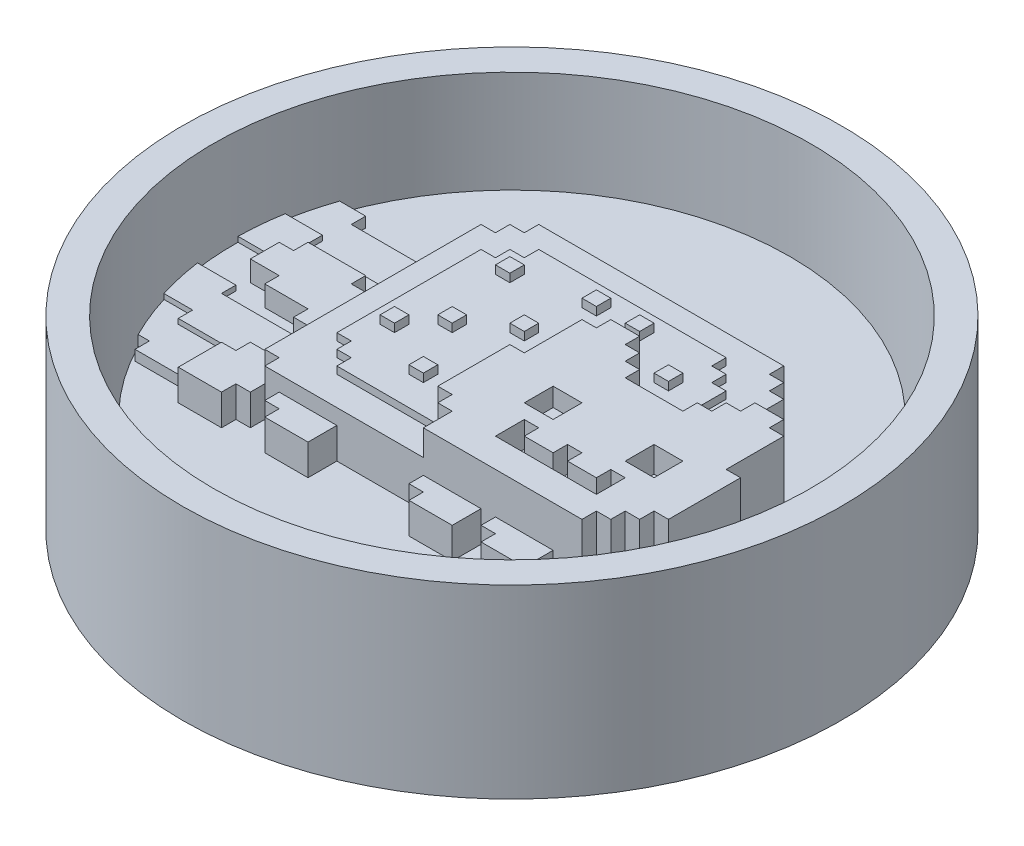
from build123d import *
from build123d.topology import SkipClean

# Parameters (mm, degrees)
FACE_3_W            = 7.112
FACE_3_H            = 7.112
FACE_2_DEPTH        = 17.78
FEETTAIL_DEPTH      = 7.62
POPTART_DEPTH       = 11.43
SPRINKLES_W         = 3.556
SPRINKLES_H         = 3.556
SPRINKLE_DEPTH      = 15.24
ENGRAVE_DEPTH       = 13.208
SKETCH2_R           = 68.58
CUPCAKE_DEPTH       = 15.24
RETAINING_START     = 21.59
SKETCH4_R           = 157.48
SKETCH4_R_2         = 73.66
RETAINING_DEPTH     = 45.72
CUPCAKE_START       = -17.78
SKETCH5_R           = 81.28
CUPCAKE_BODY_DEPTH  = 6.35
BOSS_EXTRUDE1_DEPTH = 2.54
BOSS_EXTRUDE2_DEPTH = 3.81
SKETCH15_R          = 157.48
SKETCH15_R_2        = 81.28
BOSS_EXTRUDE4_DEPTH = 45.72
SKETCH15_2_R        = 157.48
SKETCH15_2_R_2      = 81.28
CUT_EXTRUDE1_DEPTH  = 345.598533949


with BuildPart() as part:
    # face 3 → face 2 (new body)
    with BuildSketch(Plane(origin=(0, 0, 0), x_dir=(1, 0, 0), z_dir=(0, 1, 0))):
        Polygon((103.124, 88.9), (110.236, 88.9), (110.236, 85.344), (113.792, 85.344), (113.792, 81.788), (117.348, 81.788), (117.348, 78.232), (131.572, 78.232), (131.572, 81.788), (135.128, 81.788), (135.128, 85.344), (138.684, 85.344), (138.684, 88.9), (145.796, 88.9), (145.796, 85.344), (149.352, 85.344), (149.352, 71.12), (152.908, 71.12), (152.908, 53.34), (149.352, 53.34), (149.352, 49.784), (145.796, 49.784), (145.796, 46.228), (142.24, 46.228), (142.24, 42.672), (103.124, 42.672), (103.124, 49.784), (99.568, 49.784), (99.568, 53.34), (96.012, 53.34), (96.012, 71.12), (99.568, 71.12), (99.568, 85.344), (103.124, 85.344), align=None)
        with Locations((113.792, 64.008)):
            Rectangle(FACE_3_W, FACE_3_H, mode=Mode.SUBTRACT)
        with Locations((138.684, 64.008)):
            Rectangle(FACE_3_W, FACE_3_H, mode=Mode.SUBTRACT)
        Polygon((113.792, 56.896), (113.792, 49.784), (138.684, 49.784), (138.684, 56.896), (135.128, 56.896), (135.128, 53.34), (128.016, 53.34), (128.016, 56.896), (124.46, 56.896), (124.46, 53.34), (117.348, 53.34), (117.348, 56.896), align=None, mode=Mode.SUBTRACT)
    extrude(amount=FACE_2_DEPTH)

    # feet tail → feettail (add)
    with BuildSketch(Plane(origin=(0, 0, 0), x_dir=(1, 0, 0), z_dir=(0, 1, 0))):
        Polygon((60.452, 74.676), (53.34, 74.676), (53.34, 78.232), (39.116, 78.232), (39.116, 74.676), (35.56, 74.676), (35.56, 67.564), (42.672, 67.564), (42.672, 64.008), (53.34, 64.008), (53.34, 60.452), (60.452, 60.452), align=None)
        Polygon((60.452, 53.34), (56.896, 53.34), (56.896, 49.784), (53.34, 49.784), (53.34, 46.228), (49.784, 46.228), (49.784, 35.56), (60.452, 35.56), (60.452, 39.116), (64.008, 39.116), (64.008, 46.228), (60.452, 46.228), align=None)
        Polygon((67.564, 42.672), (67.564, 39.116), (71.12, 39.116), (71.12, 35.56), (81.788, 35.56), (81.788, 42.672), align=None)
        Polygon((103.124, 42.672), (103.124, 39.116), (106.68, 39.116), (106.68, 35.56), (117.348, 35.56), (117.348, 42.672), align=None)
        Polygon((120.904, 42.672), (120.904, 39.116), (124.46, 39.116), (124.46, 35.56), (135.128, 35.56), (135.128, 42.672), align=None)
    extrude(amount=FEETTAIL_DEPTH)


with BuildPart() as feettail_piece_1:
    # of the separate pieces the step leaves, piece 1, a body of its own (feettail_pieces)
    add(part.part.solids().sort_by_distance((103.124, 0, -88.9))[0])



with BuildPart() as feettail_piece_2:
    # of the separate pieces the step leaves, piece 2, a body of its own (feettail_pieces)
    add(part.part.solids().sort_by_distance((60.452, 0, -74.676))[0])


with BuildPart() as feettail_piece_3:
    # of the separate pieces the step leaves, piece 3, a body of its own (feettail_pieces)
    add(part.part.solids().sort_by_distance((60.452, 0, -53.34))[0])


with BuildPart() as feettail_piece_4:
    # of the separate pieces the step leaves, piece 4, a body of its own (feettail_pieces)
    add(part.part.solids().sort_by_distance((67.564, 0, -42.672))[0])


with BuildPart() as feettail_piece_1_1:
    add(feettail_piece_1.part)

    add(feettail_piece_3.part)  # poptart merges feettail piece 3

    add(feettail_piece_4.part)  # poptart merges feettail piece 4
    # poptart 2 → poptart (add)
    with BuildSketch(Plane(origin=(0, 0, 0), x_dir=(1, 0, 0), z_dir=(0, 1, 0))):
        Polygon((135.128, 99.568), (131.572, 99.568), (131.572, 103.124), (128.016, 103.124), (128.016, 106.68), (67.564, 106.68), (67.564, 103.124), (64.008, 103.124), (64.008, 99.568), (60.452, 99.568), (60.452, 46.228), (64.008, 46.228), (64.008, 42.672), (135.128, 42.672), (145.796, 53.34), (145.796, 71.12), (135.128, 85.344), align=None)
    extrude(amount=POPTART_DEPTH)

    # sprinkles → sprinkle (add)
    with BuildSketch(Plane(origin=(0, 0, 0), x_dir=(1, 0, 0), z_dir=(0, 1, 0))):
        with Locations((72.898, 65.786)):
            Rectangle(SPRINKLES_W, SPRINKLES_H)
        with Locations((80.01, 72.898)):
            Rectangle(SPRINKLES_W, SPRINKLES_H)
        with Locations((90.678, 80.01)):
            Rectangle(SPRINKLES_W, SPRINKLES_H)
        with Locations((76.454, 90.678)):
            Rectangle(SPRINKLES_W, SPRINKLES_H)
        with Locations((94.234, 94.234)):
            Rectangle(SPRINKLES_W, SPRINKLES_H)
        with Locations((104.902, 94.234)):
            Rectangle(SPRINKLES_W, SPRINKLES_H)
        with Locations((119.126, 87.122)):
            Rectangle(SPRINKLES_W, SPRINKLES_H)
        with Locations((87.122, 58.674)):
            Rectangle(SPRINKLES_W, SPRINKLES_H)
    extrude(amount=SPRINKLE_DEPTH)

    # engrave poptart → engrave (add)
    with BuildSketch(Plane(origin=(0, 0, 0), x_dir=(1, 0, 0), z_dir=(0, 1, 0))):
        Polygon((71.12, 53.34), (74.676, 53.34), (74.676, 49.784), (99.816268886, 49.760009936), (99.568, 49.784), (128.016, 64.008), (128.016, 67.564), (128.016, 92.456), (124.46, 92.456), (124.46, 96.012), (120.904, 96.012), (120.904, 99.568), (74.676, 99.568), (74.676, 96.012), (71.12, 96.012), (71.12, 92.456), (67.564, 92.456), (67.564, 56.896), (71.12, 56.896), align=None)
    extrude(amount=ENGRAVE_DEPTH)


    add(feettail_piece_2.part)  # CUPCAKE merges feettail piece 2
    # Sketch2 → CUPCAKE (add)
    with BuildSketch(Plane(origin=(0, 0, 0), x_dir=(1, 0, 0), z_dir=(0, 1, 0))):
        with Locations(Location((93.98, 73.66, 0), (0, 0, 270))):
            Circle(SKETCH2_R)
    extrude(amount=-CUPCAKE_DEPTH)

    # Sketch10 → Boss-Extrude1 (add)
    with SkipClean():  # the faces are left unmerged after this step: merging them gives an invalid solid
        with BuildSketch(Plane(origin=(0, 0, 0), x_dir=(1, 0, 0), z_dir=(0, 1, 0))):
            with BuildLine():
                Line((60.452, 92.456), (35.56, 92.456))
                Line((35.56, 92.456), (35.56, 96.012))
                Line((35.56, 96.012), (29.14478969, 96.012))
                ThreePointArc((29.14478969, 96.012), (27.559188352, 90.733142065), (26.402632901, 85.344))
                Line((26.402632901, 85.344), (35.56, 85.344))
                Line((35.56, 85.344), (35.56, 81.788))
                Line((35.56, 81.788), (60.452, 81.788))
                Line((60.452, 81.788), (60.452, 92.456))
            make_face()
            with BuildLine():
                Line((35.56, 74.676), (25.407526339, 74.676))
                ThreePointArc((25.407526339, 74.676), (25.53690436, 69.328827045), (26.082612009, 64.008))
                Line((26.082612009, 64.008), (35.56, 64.008))
                Line((35.56, 64.008), (35.56, 60.452))
                Line((35.56, 60.452), (53.34, 60.452))
                Line((53.34, 60.452), (53.34, 64.008))
                Line((53.34, 64.008), (42.672, 64.008))
                Line((42.672, 64.008), (42.672, 67.564))
                Line((42.672, 67.564), (35.56, 67.564))
                Line((35.56, 67.564), (35.56, 74.676))
            make_face()
            with BuildLine():
                Line((53.34, 49.784), (35.56, 49.784))
                Line((35.56, 49.784), (35.56, 53.34))
                Line((35.56, 53.34), (28.479511452, 53.34))
                ThreePointArc((28.479511452, 53.34), (30.415690351, 47.915195887), (32.800262701, 42.672))
                Line((32.800262701, 42.672), (35.56, 42.672))
                Line((35.56, 42.672), (35.56, 39.116))
                Line((35.56, 39.116), (49.784, 39.116))
                Line((49.784, 39.116), (49.784, 46.228))
                Line((49.784, 46.228), (53.34, 46.228))
                Line((53.34, 46.228), (53.34, 49.784))
            make_face()
        extrude(amount=BOSS_EXTRUDE1_DEPTH)

    # Sketch11 → Boss-Extrude2 (add)
    with SkipClean():  # the faces are left unmerged after this step: merging them gives an invalid solid
        with BuildSketch(Plane(origin=(0, 0, 0), x_dir=(1, 0, 0), z_dir=(0, 1, 0))):
            with BuildLine():
                Line((26.082612009, 64.008), (35.56, 64.008))
                Line((35.56, 64.008), (35.56, 60.452))
                Line((35.56, 60.452), (60.452, 60.452))
                Line((60.452, 60.452), (60.452, 53.34))
                Line((60.452, 53.34), (56.896, 53.34))
                Line((56.896, 53.34), (56.896, 49.784))
                Line((56.896, 49.784), (35.56, 49.784))
                Line((35.56, 49.784), (35.56, 53.34))
                Line((35.56, 53.34), (28.479511452, 53.34))
                ThreePointArc((28.479511452, 53.34), (27.068118228, 58.62615559), (26.082612009, 64.008))
            make_face()
            with BuildLine():
                Line((60.452, 81.788), (60.452, 74.676))
                Line((60.452, 74.676), (53.34, 74.676))
                Line((53.34, 74.676), (53.34, 78.232))
                Line((53.34, 78.232), (39.116, 78.232))
                Line((39.116, 78.232), (39.116, 74.676))
                Line((39.116, 74.676), (25.407526339, 74.676))
                ThreePointArc((25.407526339, 74.676), (25.696427007, 80.029463028), (26.402632901, 85.344))
                Line((26.402632901, 85.344), (35.56, 85.344))
                Line((35.56, 85.344), (35.56, 81.788))
                Line((35.56, 81.788), (60.452, 81.788))
            make_face()
        extrude(amount=BOSS_EXTRUDE2_DEPTH)


with BuildPart() as body_2:
    # Sketch4 → retaining (new body)
    with BuildSketch(Plane(origin=(0, 0, 0), x_dir=(1, 0, 0), z_dir=(0, 1, 0)).offset(RETAINING_START)):
        with Locations(Location((93.98, 73.66, 0), (0, 0, 270))):
            Circle(SKETCH4_R)
        with Locations(Location((93.98, 73.66, 0), (0, 0, 270))):
            Circle(SKETCH4_R_2, mode=Mode.SUBTRACT)
    extrude(amount=-RETAINING_DEPTH)



with BuildPart() as body_3:
    # Sketch5 → cupcake body (new body)
    with BuildSketch(Plane(origin=(0, 0, 0), x_dir=(1, 0, 0), z_dir=(0, 1, 0)).offset(CUPCAKE_START)):
        with Locations(Location((93.98, 73.66, 0), (0, 0, 270))):
            Circle(SKETCH5_R)
    extrude(amount=-CUPCAKE_BODY_DEPTH)


with BuildPart() as body_2_1:
    add(body_2.part)

    add(body_3.part)  # Boss-Extrude4 merges body 3
    # Sketch15 → Boss-Extrude4 (add, through all)
    with BuildSketch(Plane(origin=(0, 21.59, 0), x_dir=(-1, 0, 0), z_dir=(0, 1, 0))):
        with Locations(Location((-93.98, -73.66, 0), (0, 0, 90))):
            Circle(SKETCH15_R)
        with Locations((-93.98, -73.66)):
            Circle(SKETCH15_R_2, mode=Mode.SUBTRACT)
    extrude(amount=-BOSS_EXTRUDE4_DEPTH)

    # Sketch15<2> → Cut-Extrude1 (cut, through all)
    with BuildSketch(Plane(origin=(0, 21.59, 0), x_dir=(-1, 0, 0), z_dir=(0, 1, 0))):
        with Locations((-93.98, -73.66)):
            Circle(SKETCH15_2_R)
        with Locations(Location((-93.98, -73.66, 0), (0, 0, 90))):
            Circle(SKETCH15_2_R_2, mode=Mode.SUBTRACT)
    extrude(amount=-CUT_EXTRUDE1_DEPTH, mode=Mode.SUBTRACT)


solid = Compound([feettail_piece_1_1.part, body_2_1.part])
